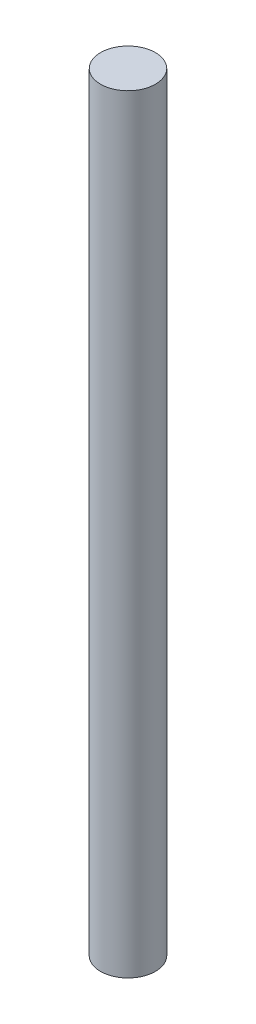
from build123d import *

# Parameters (mm, degrees)
ESBO_O1_R                = 2.38
RESSALTO_EXTRUS_O1_DEPTH = 66.689


with BuildPart() as part:
    # Esboço1 → Ressalto-extrusão1 (new body)
    with BuildSketch(Plane(origin=(0, 0, 0), x_dir=(1, 0, 0), z_dir=(0, 1, 0))):
        with Locations(Location((0, 0, 0), (0, 0, 270))):
            Circle(ESBO_O1_R)
    extrude(amount=RESSALTO_EXTRUS_O1_DEPTH)


solid = part.part
